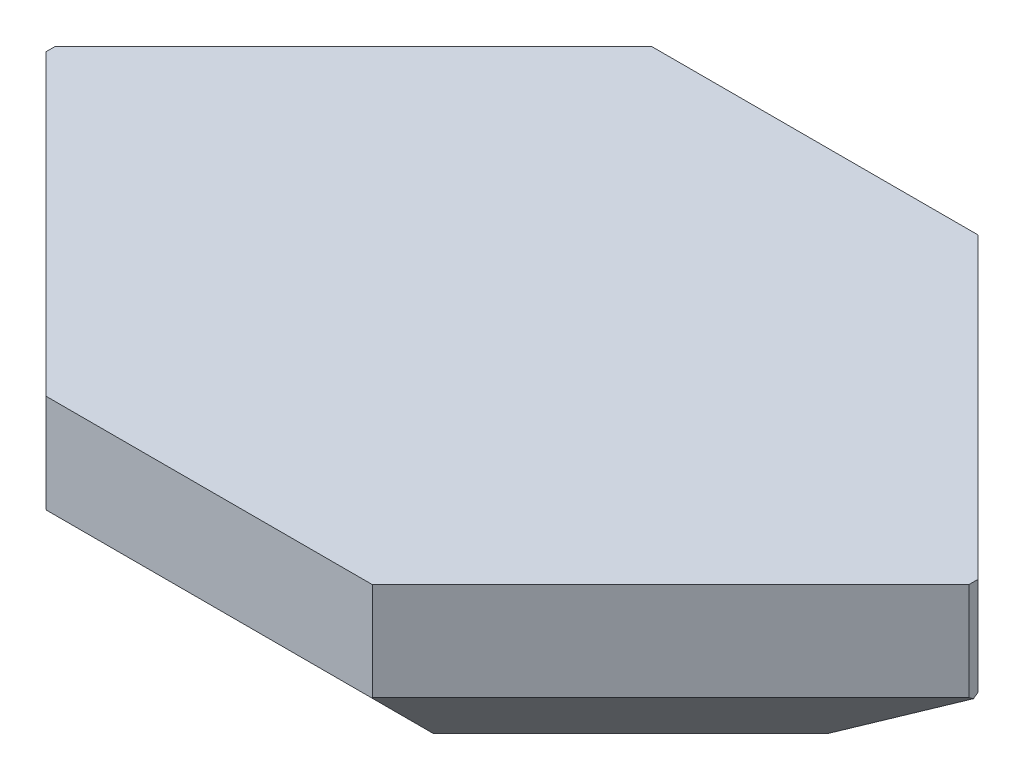
from build123d import *

# Parameters (mm, degrees)
BOSS_EXTRUDE1_DEPTH = 76.2
CHAMFER1_SIZE       = 16.51
CHAMFER2_SIZE       = 1
BOSS_EXTRUDE2_DEPTH = 6.35


with BuildPart() as part:
    # Sketch1 → Boss-Extrude1 (new body)
    with BuildSketch(Plane(origin=(0, 0, 0), x_dir=(1, 0, 0), z_dir=(0, 1, 0))):
        Polygon((-25.4, 47.146344636), (25.4, 47.146344636), (72.546344636, 0), (25.4, -47.146344636), (-25.4, -47.146344636), (-72.546344636, 0), align=None)
    extrude(amount=BOSS_EXTRUDE1_DEPTH)

    # SurfaceCut1
    split(bisect_by=Plane(origin=(0, 10.036699622, 10.036699622), x_dir=(-1, 0, 0), z_dir=(0, 0.7071067811865464, 0.7071067811865488)), keep=Keep.TOP)

    # SurfaceCut2
    split(bisect_by=Plane(origin=(0, 10.036699622, -10.036699622), x_dir=(1, 0, 0), z_dir=(0, 0.7071067811865464, -0.7071067811865488)), keep=Keep.TOP)

    # SurfaceCut3
    split(bisect_by=Plane(origin=(0, 50.8, 0), x_dir=(1, 0, 0), z_dir=(0, 1, 0)), keep=Keep.TOP)

    # Chamfer1
    chamfer1_edges = [part.edges().sort_by_distance(p)[0] for p in [
        (-57.183044257, 50.8, 15.363300378),
        (-57.183044257, 50.8, -15.363300378),
        (57.183044257, 50.8, 15.363300378),
        (57.183044257, 50.8, -15.363300378),
    ]]
    chamfer(chamfer1_edges, length=CHAMFER1_SIZE)

    # Chamfer2
    chamfer2_edges = [part.edges().sort_by_distance(p)[0] for p in [
        (72.546344636, 71.755, 0),
        (-72.546344636, 71.755, 0),
    ]]
    chamfer(chamfer2_edges, length=CHAMFER2_SIZE)

    # Sketch10 → Boss-Extrude2 (add)
    with BuildSketch(Plane(origin=(0, 76.2, 0), x_dir=(1, 0, 0), z_dir=(0, 1, 0))):
        Polygon((-25.4, 47.146344636), (-71.839237854, 0.707106781), (-71.839237854, -0.707106781), (-25.4, -47.146344636), (25.4, -47.146344636), (71.839237854, -0.707106781), (71.839237854, 0.707106781), (25.4, 47.146344636), align=None)
    extrude(amount=BOSS_EXTRUDE2_DEPTH)


solid = part.part
